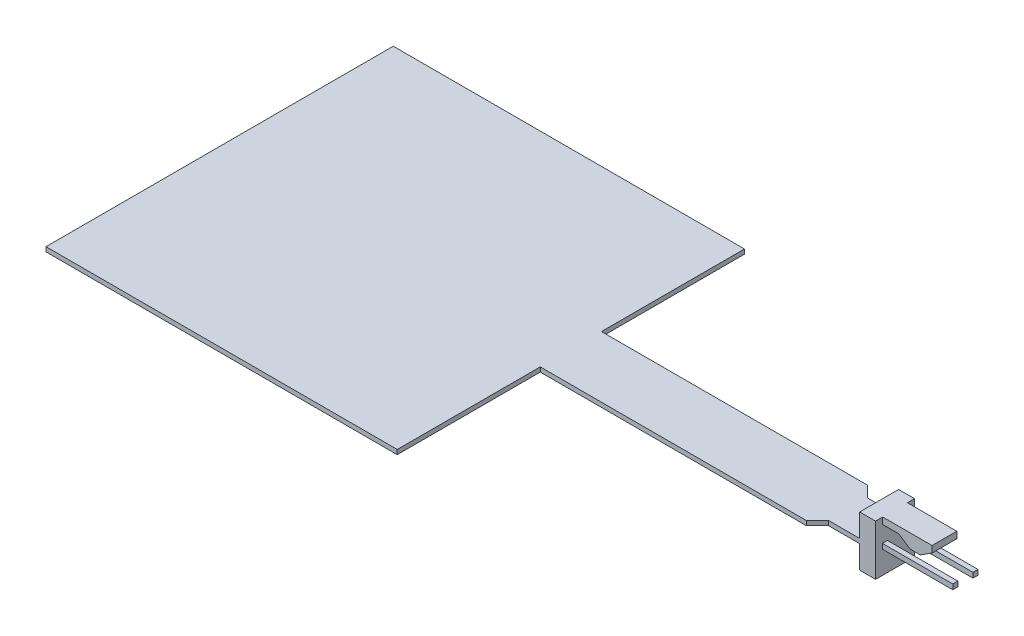
from build123d import *

# Parameters (mm, degrees)
BOSS_EXTRUDE1_DEPTH = 0.285
SKETCH2_W           = 4.9
SKETCH2_H           = 6.35
BOSS_EXTRUDE2_DEPTH = 2
BOSS_EXTRUDE3_DEPTH = 1.555
SKETCH4_W           = 0.635
SKETCH4_H           = 0.635
BOSS_EXTRUDE4_DEPTH = 8.85


with BuildPart() as part:
    # Sketch1 → Boss-Extrude1 (new, symmetric)
    with BuildSketch(Plane(origin=(0, 0, 0), x_dir=(1, 0, 0), z_dir=(0, 1, 0))):
        Polygon((22.1, 3.85), (55.58, 3.85), (56.98, 2.45), (60.9, 2.45), (60.9, -2.45), (56.98, -2.45), (55.58, -3.85), (22.1, -3.85), (22.1, -21.85), (-22.1, -21.85), (-22.1, 21.85), (22.1, 21.85), align=None)
    extrude(amount=BOSS_EXTRUDE1_DEPTH, both=True)

    # Sketch2 → Boss-Extrude2 (add)
    with BuildSketch(Plane(origin=(60.9, 0, 0), x_dir=(0, 0, -1), z_dir=(1, 0, 0))):
        Rectangle(SKETCH2_W, SKETCH2_H)
    extrude(amount=BOSS_EXTRUDE2_DEPTH)

    # Sketch3 → Boss-Extrude3 (add, symmetric)
    with BuildSketch(Plane.XY):
        Polygon((62.9, 3.175), (69.11, 3.175), (69.11, 2.355), (67.63, 1.405), (66.38, 1.405), (64.9, 2.355), (62.9, 2.355), align=None)
    extrude(amount=BOSS_EXTRUDE3_DEPTH, both=True)

    # Sketch4 → Boss-Extrude4 (add)
    with BuildSketch(Plane(origin=(62.9, 0, 0), x_dir=(0, 0, -1), z_dir=(1, 0, 0))):
        with Locations((-1.27, 0)):
            Rectangle(SKETCH4_W, SKETCH4_H)
        with Locations((1.27, 0)):
            Rectangle(SKETCH4_W, SKETCH4_H)
    extrude(amount=BOSS_EXTRUDE4_DEPTH)


solid = part.part
